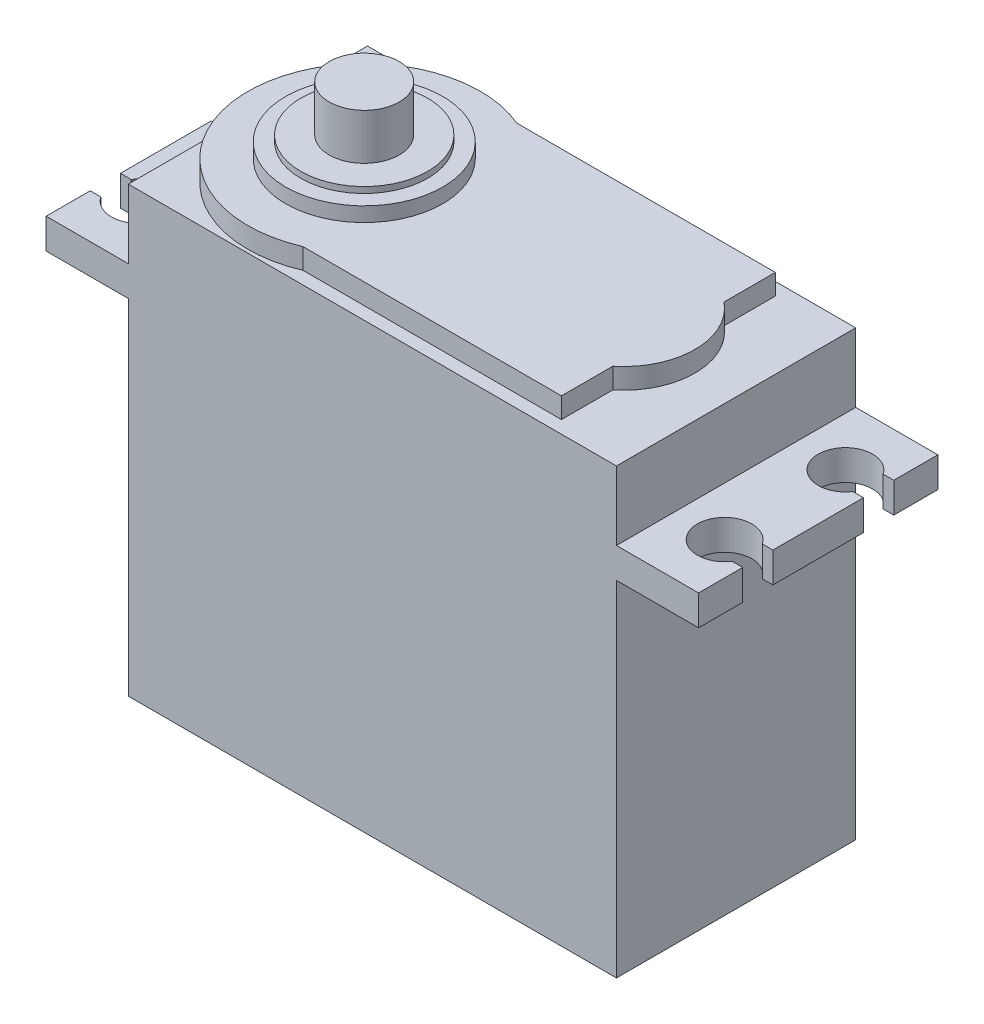
from build123d import *

# Parameters (mm, degrees)
SKETCH1_W           = 40.4
SKETCH1_H           = 19.8
BOSS_EXTRUDE1_DEPTH = 36.7
SKETCH2_R           = 9.625
BOSS_EXTRUDE2_DEPTH = 1.7
SKETCH3_R           = 6.5
BOSS_EXTRUDE3_DEPTH = 1.2
SKETCH4_R           = 5.25
BOSS_EXTRUDE4_DEPTH = 0.5
SKETCH5_R           = 2.9
BOSS_EXTRUDE5_DEPTH = 3.8
SKETCH6_W           = 19.8
SKETCH6_H           = 2.5
BOSS_EXTRUDE6_DEPTH = 6.8
SKETCH7_R           = 2.25
CUT_EXTRUDE1_DEPTH  = 6.8
SKETCH8_W           = 7.5
SKETCH8_H           = 5
BOSS_EXTRUDE7_DEPTH = 6


with BuildPart() as part:
    # Sketch1 → Boss-Extrude1 (new body)
    with BuildSketch(Plane(origin=(0, 0, 0), x_dir=(1, 0, 0), z_dir=(0, 1, 0))):
        Rectangle(SKETCH1_W, SKETCH1_H)
    extrude(amount=BOSS_EXTRUDE1_DEPTH)

    # Sketch2 → Boss-Extrude2 (add)
    with BuildSketch(Plane(origin=(0, 36.7, 0), x_dir=(1, 0, 0), z_dir=(0, 1, 0))):
        with Locations((-10.575, 0)):
            Circle(SKETCH2_R)
        with BuildLine():
            ThreePointArc((-0.95, 0), (-2.541913742, -5.301900618), (-6.791070164, -8.85))
            Line((-6.791070164, -8.85), (14.6, -8.85))
            Line((14.6, -8.85), (14.6, -4.6))
            Line((14.6, -4.6), (14.6, 4.6))
            Line((14.6, 4.6), (14.6, 8.85))
            Line((14.6, 8.85), (-6.791070164, 8.85))
            ThreePointArc((-6.791070164, 8.85), (-2.541913742, 5.301900618), (-0.95, 0))
        make_face()
        with BuildLine():
            Line((14.6, 4.6), (14.6, -4.6))
            ThreePointArc((14.6, -4.6), (16.8, 0), (14.6, 4.6))
        make_face()
    extrude(amount=BOSS_EXTRUDE2_DEPTH)

    # Sketch3 → Boss-Extrude3 (add)
    with BuildSketch(Plane(origin=(0, 38.4, 0), x_dir=(1, 0, 0), z_dir=(0, 1, 0))):
        with Locations(Location((-10.575, 0, 0), (0, 0, 270))):
            Circle(SKETCH3_R)
    extrude(amount=BOSS_EXTRUDE3_DEPTH)

    # Sketch4 → Boss-Extrude4 (add)
    with BuildSketch(Plane(origin=(0, 39.6, 0), x_dir=(1, 0, 0), z_dir=(0, 1, 0))):
        with Locations(Location((-10.575, 0, 0), (0, 0, 270))):
            Circle(SKETCH4_R)
    extrude(amount=BOSS_EXTRUDE4_DEPTH)

    # Sketch5 → Boss-Extrude5 (add)
    with BuildSketch(Plane(origin=(0, 40.1, 0), x_dir=(1, 0, 0), z_dir=(0, 1, 0))):
        with Locations(Location((-10.575, 0, 0), (0, 0, 90))):
            Circle(SKETCH5_R)
    extrude(amount=BOSS_EXTRUDE5_DEPTH)

    # Sketch6 → Boss-Extrude6 (add)
    with BuildSketch(Plane.ZY.offset(20.2)):
        with Locations((0, 29.75)):
            Rectangle(SKETCH6_W, SKETCH6_H)
    boss_extrude6 = extrude(amount=BOSS_EXTRUDE6_DEPTH)

    # Sketch7 → Cut-Extrude1 (cut)
    with BuildSketch(Plane(origin=(0, 31, 0), x_dir=(1, 0, 0), z_dir=(0, 1, 0))):
        with Locations((-24.25, 5)):
            Circle(SKETCH7_R)
        with BuildLine():
            Line((-27, 6.25), (-27, 3.75))
            Line((-27, 3.75), (-26.120828693, 3.75))
            ThreePointArc((-26.120828693, 3.75), (-26.5, 5), (-26.120828693, 6.25))
            Line((-26.120828693, 6.25), (-27, 6.25))
        make_face()
        with Locations((-24.25, -5)):
            Circle(SKETCH7_R)
        with BuildLine():
            Line((-27, -3.75), (-27, -6.25))
            Line((-27, -6.25), (-26.120828693, -6.25))
            ThreePointArc((-26.120828693, -6.25), (-26.5, -5), (-26.120828693, -3.75))
            Line((-26.120828693, -3.75), (-27, -3.75))
        make_face()
    cut_extrude1 = extrude(amount=-CUT_EXTRUDE1_DEPTH, mode=Mode.SUBTRACT)

    # Mirror1: Boss-Extrude6, Cut-Extrude1 across plane
    add(boss_extrude6.mirror(Plane(origin=(0, 0, 0), x_dir=(0, 0, 1), z_dir=(1, 0, 0))))
    add(cut_extrude1.mirror(Plane(origin=(0, 0, 0), x_dir=(0, 0, 1), z_dir=(1, 0, 0))), mode=Mode.SUBTRACT)

    # Sketch8 → Boss-Extrude7 (add)
    with BuildSketch(Plane.ZY.offset(20.2)):
        with Locations((0, 6.2)):
            Rectangle(SKETCH8_W, SKETCH8_H)
    extrude(amount=BOSS_EXTRUDE7_DEPTH)


solid = part.part
